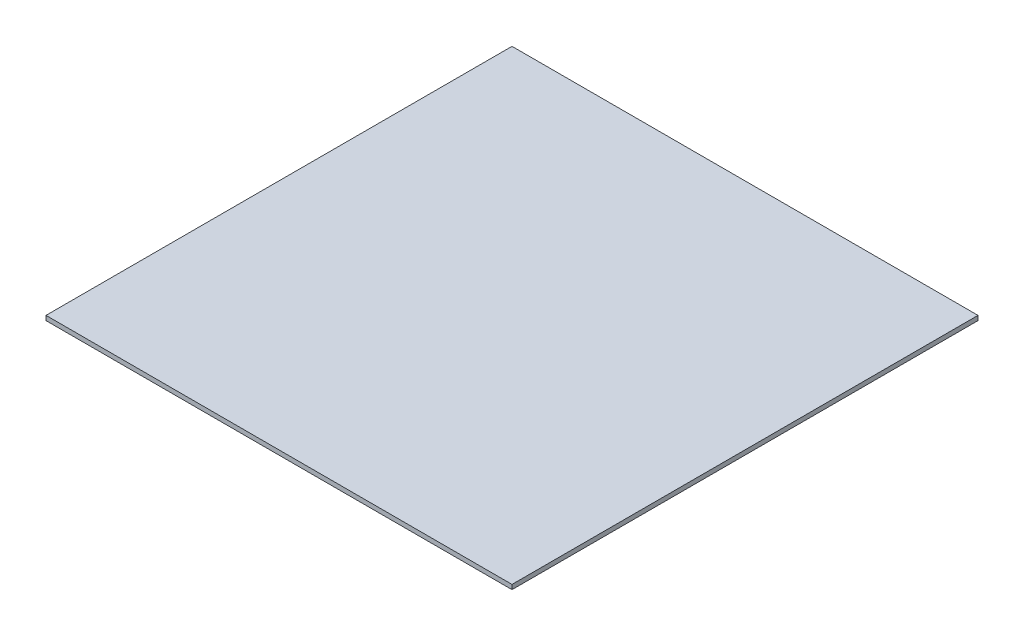
from build123d import *

# Parameters (mm, degrees)
SKETCH1_W           = 1295.4
SKETCH1_H           = 1295.4
BOSS_EXTRUDE1_DEPTH = 12.7


with BuildPart() as part:
    # Sketch1 → Boss-Extrude1 (new body)
    with BuildSketch(Plane(origin=(0, 0, 0), x_dir=(1, 0, 0), z_dir=(0, 1, 0))):
        Rectangle(SKETCH1_W, SKETCH1_H)
    extrude(amount=BOSS_EXTRUDE1_DEPTH)


solid = part.part
